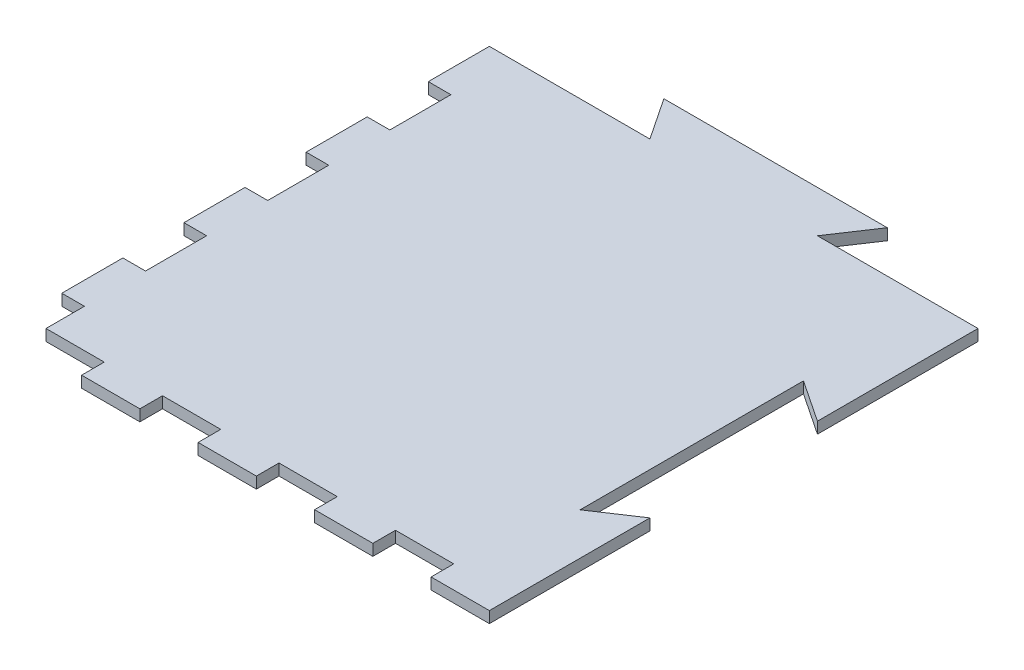
from build123d import *

# Parameters (mm, degrees)
SKETCH1_W           = 222.25
SKETCH1_H           = 222.25
BOSS_EXTRUDE1_DEPTH = 5.15
SKETCH2_W           = 26.49375
SKETCH2_H           = 10.3
SKETCH2_W_2         = 10.3
SKETCH2_H_2         = 27.78125
CUT_EXTRUDE1_DEPTH  = 315.351153171
BOSS_EXTRUDE2_DEPTH = 5.15
CUT_EXTRUDE2_DEPTH  = 329.096441614


with BuildPart() as part:
    # Sketch1 → Boss-Extrude1 (new body)
    with BuildSketch(Plane(origin=(0, 0, 0), x_dir=(1, 0, 0), z_dir=(0, 1, 0))):
        with Locations((111.125, 111.125)):
            Rectangle(SKETCH1_W, SKETCH1_H)
    extrude(amount=BOSS_EXTRUDE1_DEPTH)

    # Sketch2 → Cut-Extrude1 (cut, through all)
    with BuildSketch(Plane(origin=(0, 5.15, 0), x_dir=(1, 0, 0), z_dir=(0, 1, 0))):
        with Locations((182.509375, 5.15)):
            Rectangle(SKETCH2_W, SKETCH2_H)
        with Locations((129.521875, 5.15)):
            Rectangle(SKETCH2_W, SKETCH2_H)
        with Locations((76.534375, 5.15)):
            Rectangle(SKETCH2_W, SKETCH2_H)
        with Locations((23.546875, 5.15)):
            Rectangle(SKETCH2_W, SKETCH2_H)
        Polygon((0, 0), (10.3, 0), (10.3, 10.3), (10.3, 27.78125), (0, 27.78125), align=None)
        with Locations((5.15, 69.453125)):
            Rectangle(SKETCH2_W_2, SKETCH2_H_2)
        with Locations((5.15, 125.015625)):
            Rectangle(SKETCH2_W_2, SKETCH2_H_2)
        with Locations((5.15, 180.578125)):
            Rectangle(SKETCH2_W_2, SKETCH2_H_2)
    extrude(amount=-CUT_EXTRUDE1_DEPTH, mode=Mode.SUBTRACT)

    # Sketch3 → Boss-Extrude2 (add)
    with BuildSketch(Plane(origin=(0, 5.15, 0), x_dir=(1, 0, 0), z_dir=(0, 1, 0))):
        Polygon((73.025, 222.25), (60.325, 241.3), (161.925, 241.3), (149.225, 222.25), align=None)
    extrude(amount=-BOSS_EXTRUDE2_DEPTH)

    # Sketch4 → Cut-Extrude2 (cut, through all)
    with BuildSketch(Plane(origin=(0, 5.15, 0), x_dir=(1, 0, 0), z_dir=(0, 1, 0))):
        Polygon((222.25, 73.025), (203.2, 60.325), (203.2, 161.925), (222.25, 149.225), align=None)
    extrude(amount=-CUT_EXTRUDE2_DEPTH, mode=Mode.SUBTRACT)


solid = part.part
